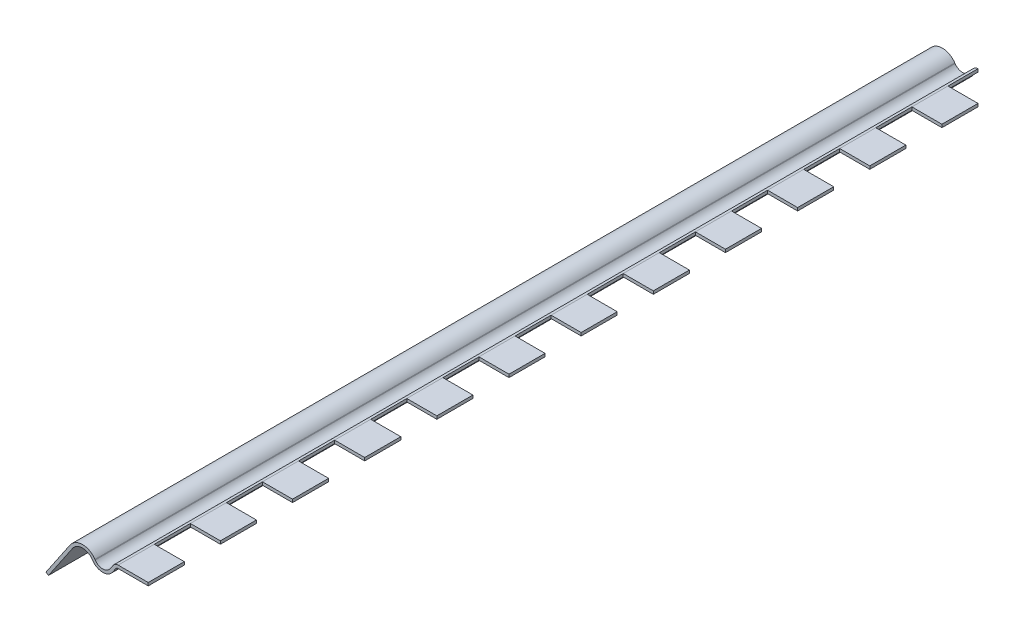
from build123d import *

# Parameters (mm, degrees)
BOSS_EXTRUDE1_DEPTH = 71.5
SKETCH3_W           = 5
SKETCH3_H           = 6
CUT_EXTRUDE1_DEPTH  = 74.85295489
LPATTERN1_COUNT     = 12
LPATTERN1_PITCH     = 12


with BuildPart() as part:
    # Sketch1 → Boss-Extrude1 (new, symmetric)
    with BuildSketch(Plane.XY):
        with BuildLine():
            Line((0, 0), (-5, 0))
            ThreePointArc((-5, 0), (-5.468268863, -0.11641397), (-5.827511651, -0.438551456))
            Line((-5.827511651, -0.438551456), (-6.324130952, -1.170512135))
            ThreePointArc((-6.324130952, -1.170512135), (-7.565398428, -1.828339319), (-8.806665905, -1.170512135))
            Line((-8.806665905, -1.170512135), (-8.856963859, -1.096378639))
            ThreePointArc((-8.856963859, -1.096378639), (-10.925742986, 0), (-12.994522113, -1.096378639))
            Line((-12.994522113, -1.096378639), (-17, -7))
            Line((-17, -7), (-16.586244175, -7.280724272))
            Line((-16.586244175, -7.280724272), (-12.580766288, -1.377102912))
            ThreePointArc((-12.580766288, -1.377102912), (-10.925742986, -0.5), (-9.270719684, -1.377102912))
            Line((-9.270719684, -1.377102912), (-9.22042173, -1.451236407))
            ThreePointArc((-9.22042173, -1.451236407), (-7.565398428, -2.328339319), (-5.910375127, -1.451236407))
            Line((-5.910375127, -1.451236407), (-5.413755825, -0.719275728))
            ThreePointArc((-5.413755825, -0.719275728), (-5.234134431, -0.558206985), (-5, -0.5))
            Line((-5, -0.5), (0, -0.5))
            Line((0, -0.5), (0, 0))
        make_face()
    extrude(amount=BOSS_EXTRUDE1_DEPTH, both=True)

    # Sketch3 → Cut-Extrude1 (cut, through all)
    with BuildSketch(Plane(origin=(0, 0, 0), x_dir=(1, 0, 0), z_dir=(0, 1, 0))):
        with Locations((-2.5, -62.5)):
            Rectangle(SKETCH3_W, SKETCH3_H)
    cut_extrude1 = extrude(amount=-CUT_EXTRUDE1_DEPTH, mode=Mode.SUBTRACT)

    # LPattern1: Cut-Extrude1 ×12
    with Locations(*[(0, 0, -i * LPATTERN1_PITCH) for i in range(1, LPATTERN1_COUNT)]):
        add(cut_extrude1, mode=Mode.SUBTRACT)


solid = part.part
